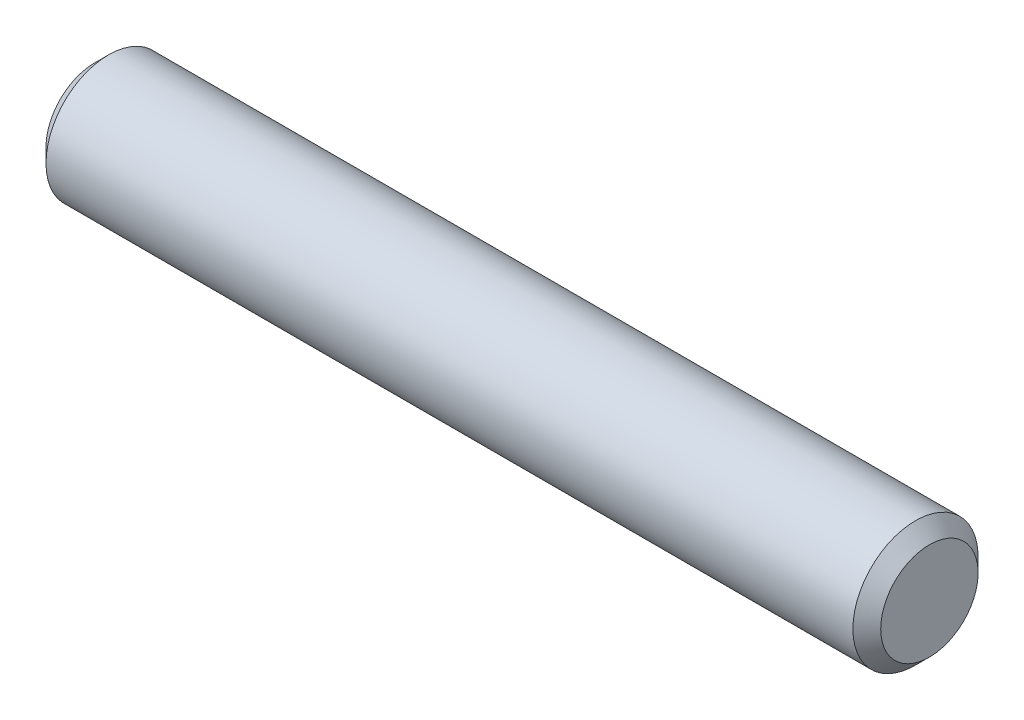
from build123d import *

# Parameters (mm, degrees)
SKETCH_1_W     = 12
SKETCH_1_H     = 0.9
CHAMFER_1_SIZE = 0.2


with BuildPart() as part:
    # 草图1 → 旋转1 (revolve)
    with BuildSketch(Plane.XY, mode=Mode.PRIVATE) as revolve_1_sk:
        with Locations((0.657303371, 0.45)):
            Rectangle(SKETCH_1_W, SKETCH_1_H)
    revolve(revolve_1_sk.sketch.rotate(Axis((-6.320224719, 0, 0), (1, 0, 0)), 90), axis=Axis((-6.320224719, 0, 0), (1, 0, 0)))

    # 倒角1
    chamfer_1_edges = [part.edges().sort_by_distance(p)[0] for p in [
        (6.657303371, 0, -0.9),
        (-5.342696629, 0, -0.9),
    ]]
    chamfer(chamfer_1_edges, length=CHAMFER_1_SIZE)


solid = part.part
